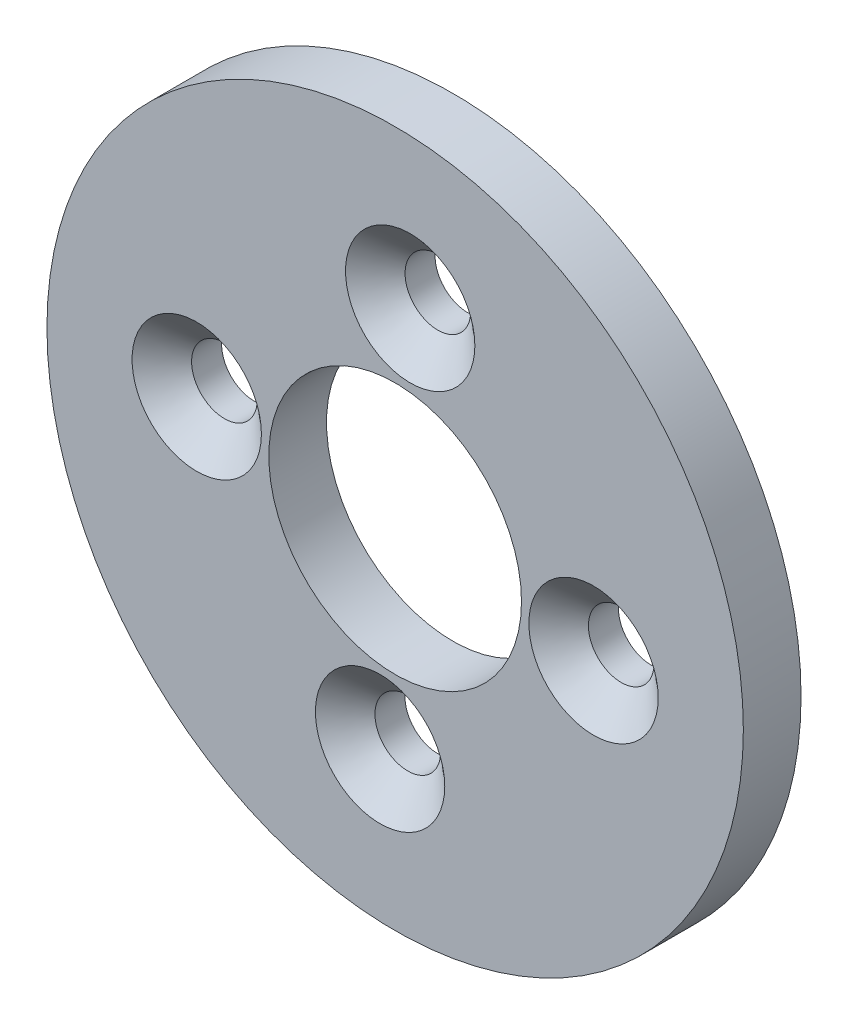
from build123d import *

# Parameters (mm, degrees)
SKETCH1_R           = 17.5
BOSS_EXTRUDE1_DEPTH = 2.9
SKETCH2_R           = 1.65
CUT_EXTRUDE1_DEPTH  = 25.918065736
CHAMFER1_SIZE       = 1.6
CHAMFER1_SIZE2      = 1.390858781
SKETCH3_R           = 6.35
CUT_EXTRUDE2_DEPTH  = 25.918065736


with BuildPart() as part:
    # Sketch1 → Boss-Extrude1 (new body)
    with BuildSketch(Plane.XY):
        Circle(SKETCH1_R)
    extrude(amount=BOSS_EXTRUDE1_DEPTH)

    # Sketch2 → Cut-Extrude1 (cut, through all)
    with BuildSketch(Plane.XY.offset(2.9)):
        with Locations((-9.971337593, 0.756588791)):
            Circle(SKETCH2_R)
        with Locations((-0.756588791, -9.971337593)):
            Circle(SKETCH2_R)
        with Locations((9.971337593, -0.756588791)):
            Circle(SKETCH2_R)
        with Locations((0.756588791, 9.971337593)):
            Circle(SKETCH2_R)
    extrude(amount=-CUT_EXTRUDE1_DEPTH, mode=Mode.SUBTRACT)

    # Chamfer1
    chamfer1_edges = [part.edges().sort_by_distance(p)[0] for p in [
        (-2.406588791, -9.971337593, 2.9),
        (8.321337593, -0.756588791, 2.9),
        (-0.893411209, 9.971337593, 2.9),
        (-11.621337593, 0.756588791, 2.9),
    ]]
    chamfer1_side = [part.faces().sort_by_distance(p)[0] for p in [
        (0, 0, 2.9),
    ]]
    chamfer(chamfer1_edges, length=CHAMFER1_SIZE, length2=CHAMFER1_SIZE2, reference=chamfer1_side[0])

    # Sketch3 → Cut-Extrude2 (cut, through all)
    with BuildSketch(Plane.XY.offset(2.9)):
        Circle(SKETCH3_R)
    extrude(amount=-CUT_EXTRUDE2_DEPTH, mode=Mode.SUBTRACT)


solid = part.part
